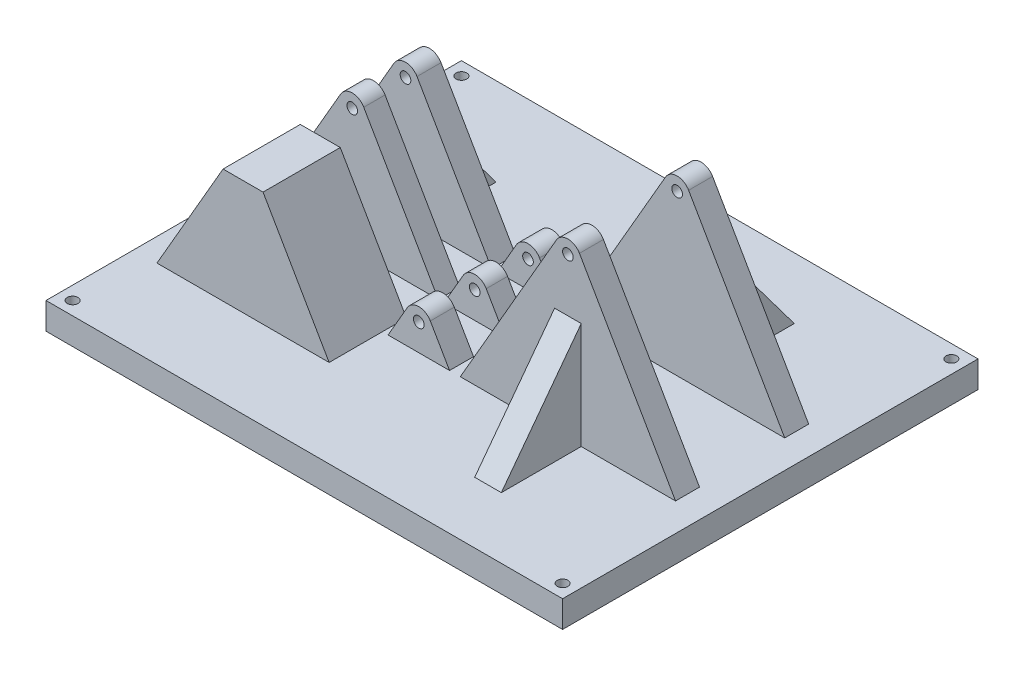
from build123d import *

# Parameters (mm, degrees)
SKETCH2_R             = 2
BOSS_EXTRUDE2_DEPTH   = 5
BOSS_EXTRUDE2_2_DEPTH = 5
BOSS_EXTRUDE2_3_DEPTH = 5
SKETCH3_W             = 194
SKETCH3_H             = 156
BOSS_EXTRUDE3_DEPTH   = 10
SKETCH5_R             = 2
BOSS_EXTRUDE4_DEPTH   = 10
SKETCH6_W             = 80.829037686
SKETCH6_H             = 10
CUT_EXTRUDE1_DEPTH    = 142
SKETCH7_R             = 2
CUT_EXTRUDE2_DEPTH    = 142
CUT_EXTRUDE4_DEPTH    = 10
BOSS_EXTRUDE5_DEPTH   = 20
SKETCH10_R            = 2
CUT_EXTRUDE5_DEPTH    = 1
CUT_EXTRUDE6_DEPTH    = 1
BOSS_EXTRUDE6_DEPTH   = 5
BOSS_EXTRUDE7_DEPTH   = 5


with BuildPart() as part:
    # Sketch2 → Boss-Extrude2 (new, symmetric)
    with BuildSketch(Plane.XY):
        with BuildLine():
            ThreePointArc((50.330127019, 12.5), (46, 15), (41.669872981, 12.5))
            Line((41.669872981, 12.5), (5.585481157, -50))
            Line((5.585481157, -50), (86.414518843, -50))
            Line((86.414518843, -50), (50.330127019, 12.5))
        make_face()
        with Locations((46, 10)):
            Circle(SKETCH2_R, mode=Mode.SUBTRACT)
    extrude(amount=BOSS_EXTRUDE2_DEPTH, both=True)



with BuildPart() as body_2:
    # Sketch2 → Boss-Extrude2 2 (new, symmetric)
    with BuildSketch(Plane.XY):
        with BuildLine():
            Line((-21.547005384, -50), (1.547005384, -50))
            Line((1.547005384, -50), (-5.669872981, -37.5))
            ThreePointArc((-5.669872981, -37.5), (-10, -35), (-14.330127019, -37.5))
            Line((-14.330127019, -37.5), (-21.547005384, -50))
        make_face()
        with Locations((-10, -40)):
            Circle(SKETCH2_R, mode=Mode.SUBTRACT)
    extrude(amount=BOSS_EXTRUDE2_2_DEPTH, both=True)


with BuildPart() as body_3:
    # Sketch2 → Boss-Extrude2 3 (new, symmetric)
    with BuildSketch(Plane.XY):
        with BuildLine():
            Line((-88.331615075, -50), (-23.668384925, -50))
            Line((-23.668384925, -50), (-51.669872981, -1.5))
            ThreePointArc((-51.669872981, -1.5), (-56, 1), (-60.330127019, -1.5))
            Line((-60.330127019, -1.5), (-88.331615075, -50))
        make_face()
        with Locations((-56, -4)):
            Circle(SKETCH2_R, mode=Mode.SUBTRACT)
    extrude(amount=BOSS_EXTRUDE2_3_DEPTH, both=True)


with BuildPart() as part_1:
    add(part.part)

    add(body_2.part)  # Boss-Extrude3 merges body 2

    add(body_3.part)  # Boss-Extrude3 merges body 3
    # Sketch3 → Boss-Extrude3 (add)
    with BuildSketch(Plane(origin=(0, -50, 0), x_dir=(-1, 0, 0), z_dir=(0, -1, 0))):
        Rectangle(SKETCH3_W, SKETCH3_H)
    extrude(amount=BOSS_EXTRUDE3_DEPTH)

    # Sketch5 → Boss-Extrude4 (add)
    # profile 1 of 3: a face of its own
    with BuildSketch(Plane.XY.offset(15)):
        with BuildLine():
            ThreePointArc((50.330127019, 12.5), (46, 15), (41.669872981, 12.5))
            Line((41.669872981, 12.5), (5.585481157, -50))
            Line((5.585481157, -50), (86.414518843, -50))
            Line((86.414518843, -50), (50.330127019, 12.5))
        make_face()
        with Locations((46, 10)):
            Circle(SKETCH5_R, mode=Mode.SUBTRACT)
    # profile 2 of 3: a face of its own
    with BuildSketch(Plane.XY.offset(15)):
        with BuildLine():
            Line((-21.547005384, -50), (1.547005384, -50))
            Line((1.547005384, -50), (-5.669872981, -37.5))
            ThreePointArc((-5.669872981, -37.5), (-10, -35), (-14.330127019, -37.5))
            Line((-14.330127019, -37.5), (-21.547005384, -50))
        make_face()
        with Locations((-10, -40)):
            Circle(SKETCH5_R, mode=Mode.SUBTRACT)
    # profile 3 of 3: a face of its own
    with BuildSketch(Plane.XY.offset(15)):
        with BuildLine():
            Line((-88.331615075, -50), (-23.668384925, -50))
            Line((-23.668384925, -50), (-51.669872981, -1.5))
            ThreePointArc((-51.669872981, -1.5), (-56, 1), (-60.330127019, -1.5))
            Line((-60.330127019, -1.5), (-88.331615075, -50))
        make_face()
        with Locations((-56, -4)):
            Circle(SKETCH5_R, mode=Mode.SUBTRACT)
    boss_extrude4 = extrude(amount=BOSS_EXTRUDE4_DEPTH)

    # Mirror1: Boss-Extrude4 across plane
    add(boss_extrude4.mirror(Plane.XY))

    # Sketch6 → Cut-Extrude1 (cut)
    with BuildSketch(Plane(origin=(0, -50, 0), x_dir=(1, 0, 0), z_dir=(0, 1, 0))):
        with Locations((46, 0)):
            Rectangle(SKETCH6_W, SKETCH6_H)
    extrude(amount=CUT_EXTRUDE1_DEPTH, mode=Mode.SUBTRACT)

    # Sketch7 → Cut-Extrude2 (cut)
    with BuildSketch(Plane(origin=(0, -50, 0), x_dir=(1, 0, 0), z_dir=(0, 1, 0))):
        with Locations((-92, -73)):
            Circle(SKETCH7_R)
        with Locations((-92, 73)):
            Circle(SKETCH7_R)
        with Locations((92, 73)):
            Circle(SKETCH7_R)
        with Locations((92, -73)):
            Circle(SKETCH7_R)
    extrude(amount=-CUT_EXTRUDE2_DEPTH, mode=Mode.SUBTRACT)

    # Sketch8 → Cut-Extrude4 (cut)
    with BuildSketch(Plane.XY.offset(25)):
        Polygon((-71, -7), (-41, -7), (-41, -1), (-41, 3.028567104), (-71, 3.028567104), (-71, -1), align=None)
    extrude(amount=-CUT_EXTRUDE4_DEPTH, mode=Mode.SUBTRACT)

    # Sketch9 → Boss-Extrude5 (add)
    with BuildSketch(Plane.XY.offset(25)):
        Polygon((-88.331615075, -50), (-23.668384925, -50), (-48.494446501, -7), (-63.505553499, -7), align=None)
    extrude(amount=BOSS_EXTRUDE5_DEPTH)

    # Sketch10 → Cut-Extrude5 (cut)
    # profile 1 of 2: a face of its own
    with BuildSketch(Plane.XY.offset(5)):
        with BuildLine():
            Line((-60.330127019, -1.5), (-88.331615075, -50))
            Line((-88.331615075, -50), (-23.668384925, -50))
            Line((-23.668384925, -50), (-51.669872981, -1.5))
            ThreePointArc((-51.669872981, -1.5), (-56, 1), (-60.330127019, -1.5))
        make_face()
        with Locations((-56, -4)):
            Circle(SKETCH10_R, mode=Mode.SUBTRACT)
    # profile 2 of 2: a face of its own
    with BuildSketch(Plane.XY.offset(5)):
        with BuildLine():
            Line((-21.547005384, -50), (-14.330127019, -37.5))
            ThreePointArc((-14.330127019, -37.5), (-10, -35), (-5.669872981, -37.5))
            Line((-5.669872981, -37.5), (1.547005384, -50))
            Line((1.547005384, -50), (-21.547005384, -50))
        make_face()
    cut_extrude5 = extrude(amount=-CUT_EXTRUDE5_DEPTH, mode=Mode.SUBTRACT)

    # Mirror2: Cut-Extrude5 across plane
    add(cut_extrude5.mirror(Plane.XY), mode=Mode.SUBTRACT)

    # Sketch11 → Cut-Extrude6 (cut)
    with BuildSketch(Plane.XY.offset(-15)):
        with BuildLine():
            Line((-88.331615075, -50), (-23.668384925, -50))
            Line((-23.668384925, -50), (-51.669872981, -1.5))
            ThreePointArc((-51.669872981, -1.5), (-56, 1), (-60.330127019, -1.5))
            Line((-60.330127019, -1.5), (-88.331615075, -50))
        make_face()
        with BuildLine():
            Line((-21.547005384, -50), (1.547005384, -50))
            Line((1.547005384, -50), (-5.669872981, -37.5))
            ThreePointArc((-5.669872981, -37.5), (-10, -35), (-14.330127019, -37.5))
            Line((-14.330127019, -37.5), (-21.547005384, -50))
        make_face()
        with BuildLine():
            Line((5.585481157, -50), (41.669872981, 12.5))
            ThreePointArc((41.669872981, 12.5), (46, 15), (50.330127019, 12.5))
            Line((50.330127019, 12.5), (86.414518843, -50))
            Line((86.414518843, -50), (5.585481157, -50))
        make_face()
    cut_extrude6 = extrude(amount=-CUT_EXTRUDE6_DEPTH, mode=Mode.SUBTRACT)

    # Mirror3: Cut-Extrude6 across plane
    add(cut_extrude6.mirror(Plane.XY), mode=Mode.SUBTRACT)

    # Sketch12 → Boss-Extrude6 (add, symmetric)
    with BuildSketch(Plane(origin=(46, 0, 0), x_dir=(0, 0, -1), z_dir=(1, 0, 0))):
        Polygon((-55, -50), (-25, -10), (-25, -50), align=None)
    boss_extrude6 = extrude(amount=BOSS_EXTRUDE6_DEPTH, both=True)

    # Mirror4: Boss-Extrude6 across plane
    add(boss_extrude6.mirror(Plane.XY))

    # Sketch13 → Boss-Extrude7 (add, symmetric)
    with BuildSketch(Plane.ZY.offset(56)):
        Polygon((-45, -50), (-25, -23.333333333), (-25, -50), align=None)
    extrude(amount=BOSS_EXTRUDE7_DEPTH, both=True)


solid = part_1.part
